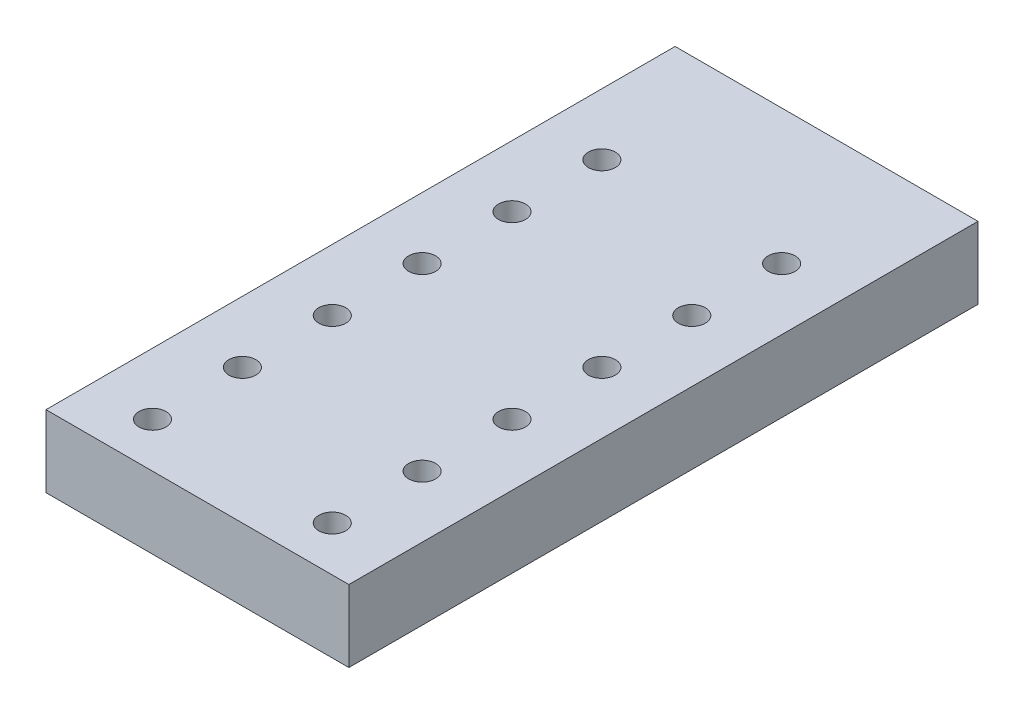
from build123d import *

# Parameters (mm, degrees)
SKETCH_1_W             = 33.7
SKETCH_1_H             = 8
EXTRUDE_1_DEPTH        = 70
SKETCH_2_R             = 2.5
CUT_EXTRUDE_1_DEPTH    = 10
SKETCH_3_R             = 2.5
CUT_EXTRUDE_2_DEPTH    = 4
SKETCH_4_R             = 1.5
CUT_EXTRUDE_3_DEPTH    = 4
PATTERN_LINEAR_1_COUNT = 6
PATTERN_LINEAR_1_PITCH = 10


with BuildPart() as part:
    # 草图1 → 凸台-拉伸1 (new body)
    with BuildSketch(Plane.XY):
        Rectangle(SKETCH_1_W, SKETCH_1_H)
    extrude(amount=EXTRUDE_1_DEPTH)

    # 草图2 → 切除-拉伸1 (cut)
    with BuildSketch(Plane(origin=(0, 0, 0), x_dir=(-1, 0, 0), z_dir=(0, 0, -1))):
        with Locations((10, 0)):
            Circle(SKETCH_2_R)
        with Locations((-10, 0)):
            Circle(SKETCH_2_R)
    extrude(amount=-CUT_EXTRUDE_1_DEPTH, mode=Mode.SUBTRACT)

    # 草图3 → 切除-拉伸2 (cut)
    with BuildSketch(Plane.XZ.offset(4)):
        with Locations(Location((-10, 15, 0), (0, 0, 270))):
            Circle(SKETCH_3_R)
        with Locations(Location((10, 15, 0), (0, 0, 270))):
            Circle(SKETCH_3_R)
    cut_extrude_2 = extrude(amount=-CUT_EXTRUDE_2_DEPTH, mode=Mode.SUBTRACT)

    # 草图4 → 切除-拉伸3 (cut)
    with BuildSketch(Plane(origin=(0, 0, 0), x_dir=(-1, 0, 0), z_dir=(0, -1, 0))):
        with Locations(Location((10, -15, 0), (0, 0, 90))):
            Circle(SKETCH_4_R)
        with Locations(Location((-10, -15, 0), (0, 0, 90))):
            Circle(SKETCH_4_R)
    cut_extrude_3 = extrude(amount=-CUT_EXTRUDE_3_DEPTH, mode=Mode.SUBTRACT)

    # 阵列(线性)1: 切除-拉伸2, 切除-拉伸3 ×6
    with Locations(*[(0, 0, i * PATTERN_LINEAR_1_PITCH) for i in range(1, PATTERN_LINEAR_1_COUNT)]):
        add(cut_extrude_2, mode=Mode.SUBTRACT)
        add(cut_extrude_3, mode=Mode.SUBTRACT)


solid = part.part
